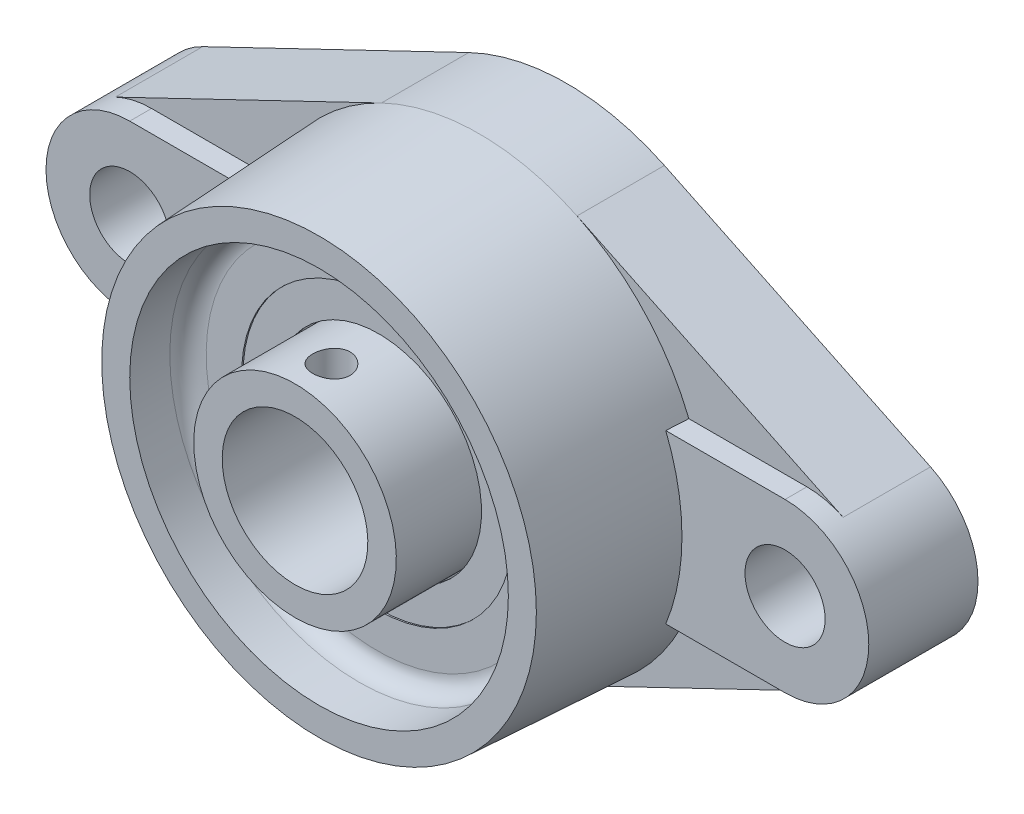
from build123d import *

# Parameters (mm, degrees)
SKETCH_2_R               = 5.5
EXTRUDE_671_DEPTH        = 12
SKETCH_3_R               = 5.5
EXTRUDE_1_DEPTH          = 15
SKETCH_4_R               = 31
EXTRUDE_2_DEPTH          = 22
EXTRUDE_2_TAPER          = 3
CUT_EXTRUDE_2_DEPTH      = 3
PATTERN_CIRCULAR_1_COUNT = 2
SKETCH_11_W              = 31
SKETCH_11_H              = 3.915
SKETCH_12_W              = 0.2
SKETCH_12_H              = 4.725
SKETCH_13_W              = 2.567
SKETCH_13_H              = 15.915


with BuildPart() as part:
    # 草图2 → Extrude 671 (new body)
    with BuildSketch(Plane.XY):
        with BuildLine():
            Line((-49.983333333, 10.364187807), (-13.433333333, 27.938245391))
            ThreePointArc((-13.433333333, 27.938245391), (0, 31), (13.433333333, 27.938245391))
            Line((13.433333333, 27.938245391), (49.983333333, 10.364187807))
            ThreePointArc((49.983333333, 10.364187807), (56.5, 0), (49.983333333, -10.364187807))
            Line((49.983333333, -10.364187807), (13.433333333, -27.938245391))
            ThreePointArc((13.433333333, -27.938245391), (0, -31), (-13.433333333, -27.938245391))
            Line((-13.433333333, -27.938245391), (-49.983333333, -10.364187807))
            ThreePointArc((-49.983333333, -10.364187807), (-56.5, 0), (-49.983333333, 10.364187807))
        make_face()
        with Locations((-45, 0)):
            Circle(SKETCH_2_R, mode=Mode.SUBTRACT)
        with Locations(Location((45, 0, 0), (0, 0, 180))):
            Circle(SKETCH_2_R, mode=Mode.SUBTRACT)
    extrude(amount=EXTRUDE_671_DEPTH)

    # 草图3 → 凸台-拉伸1 (add)
    with BuildSketch(Plane.XY):
        with BuildLine():
            Line((-45, 11.5), (45, 11.5))
            ThreePointArc((45, 11.5), (56.5, 0), (45, -11.5))
            Line((45, -11.5), (-45, -11.5))
            ThreePointArc((-45, -11.5), (-56.5, 0), (-45, 11.5))
        make_face()
        with Locations(Location((45, 0, 0), (0, 0, 180))):
            Circle(SKETCH_3_R, mode=Mode.SUBTRACT)
        with Locations((-45, 0)):
            Circle(SKETCH_3_R, mode=Mode.SUBTRACT)
    extrude(amount=EXTRUDE_1_DEPTH)

    # 草图4 → 凸台-拉伸2 (add)
    with BuildSketch(Plane.XY.offset(12)):
        Circle(SKETCH_4_R)
    extrude(amount=EXTRUDE_2_DEPTH, taper=EXTRUDE_2_TAPER)

    # 草图5 → 切除-拉伸2 (cut)
    with BuildSketch(Plane(origin=(0, 0, 0), x_dir=(-1, 0, 0), z_dir=(0, 0, -1))):
        with BuildLine():
            Line((-34.96012629, 11.740142073), (-11.149666667, 23.188743675))
            ThreePointArc((-11.149666667, 23.188743675), (0, 25.73), (11.149666667, 23.188743675))
            Line((11.149666667, 23.188743675), (34.96012629, 11.740142073))
            ThreePointArc((34.96012629, 11.740142073), (36.584583298, 9.705433588), (36.006307058, 7.166832443))
            ThreePointArc((36.006307058, 7.166832443), (33.5, 0), (36.006307058, -7.166832443))
            ThreePointArc((36.006307058, -7.166832443), (36.584583298, -9.705433588), (34.96012629, -11.740142073))
            Line((34.96012629, -11.740142073), (11.149666667, -23.188743675))
            ThreePointArc((11.149666667, -23.188743675), (0, -25.73), (-11.149666667, -23.188743675))
            Line((-11.149666667, -23.188743675), (-34.96012629, -11.740142073))
            ThreePointArc((-34.96012629, -11.740142073), (-36.584583298, -9.705433588), (-36.006307058, -7.166832443))
            ThreePointArc((-36.006307058, -7.166832443), (-33.5, 0), (-36.006307058, 7.166832443))
            ThreePointArc((-36.006307058, 7.166832443), (-36.584583298, 9.705433588), (-34.96012629, 11.740142073))
        make_face()
    extrude(amount=-CUT_EXTRUDE_2_DEPTH, mode=Mode.SUBTRACT)

    # 草图6 → 切除-旋转1 (revolve, cut)
    with BuildSketch(Plane(origin=(0, 0, 0), x_dir=(0, 0, -1), z_dir=(1, 0, 0))):
        with BuildLine():
            Line((-36, 26), (-28.5, 26))
            ThreePointArc((-28.5, 26), (-26.732233047, 25.267766953), (-26, 23.5))
            Line((-26, 23.5), (-26, 22.433234274))
            ThreePointArc((-26, 22.433234274), (-24.841010415, 22.762526163), (-23.666666667, 23.031982594))
            Line((-23.666666667, 23.031982594), (-23.666666667, 25.267766953))
            Line((-23.666666667, 25.267766953), (-21.333333333, 25.267766953))
            Line((-21.333333333, 25.267766953), (-21.333333333, 23.383873836))
            ThreePointArc((-21.333333333, 23.383873836), (-16.618745428, 23.379042467), (-12, 22.433234274))
            Line((-12, 22.433234274), (-12, 23.5))
            ThreePointArc((-12, 23.5), (-11.267766953, 25.267766953), (-9.5, 26))
            Line((-9.5, 26), (2, 26))
            Line((2, 26), (2, 0))
            Line((2, 0), (-36, 0))
            Line((-36, 0), (-36, 26))
        make_face()
    revolve(axis=Axis((0, 0, 0), (0, 0, 1)), mode=Mode.SUBTRACT)

    # 草图7 → 凸台-旋转1 (revolve)
    with BuildSketch(Plane.XY.offset(18.5)):
        with BuildLine():
            Line((-21.679433892, -21.679433892), (-18.850924901, -24.507942884))
            Line((-18.850924901, -24.507942884), (-19.156642158, -24.813660141))
            ThreePointArc((-19.156642158, -24.813660141), (-19.904442449, -25.676726722), (-20.521738978, -26.637473407))
            ThreePointArc((-20.521738978, -26.637473407), (-22.766611284, -28.272961601), (-25.455384104, -27.576704447))
            Line((-25.455384104, -27.576704447), (-26.0493538, -26.982734751))
            ThreePointArc((-26.0493538, -26.982734751), (-26.516044275, -27.176044275), (-26.982734751, -26.982734751))
            Line((-26.982734751, -26.982734751), (-21.679433892, -21.679433892))
        make_face()
    revolve(axis=Axis((-26.982734751, -26.982734751, 18.5), (0.7071067811865517, 0.7071067811865434, 0)))

    # 草图8 → 凸台-旋转2 (revolve)
    with BuildSketch(Plane(origin=(0, 0, 0), x_dir=(0, 0, -1), z_dir=(1, 0, 0)), mode=Mode.PRIVATE) as revolve_2_sk:
        with BuildLine():
            Line((-26, 22.433234274), (-26, 18.64))
            Line((-26, 18.64), (-12, 18.64))
            Line((-12, 18.64), (-12, 22.433234274))
            ThreePointArc((-12, 22.433234274), (-19, 23.5), (-26, 22.433234274))
        make_face()
    revolve(revolve_2_sk.sketch.rotate(Axis((0, 0, 19), (0, 0, -1)), 180), axis=Axis((0, 0, 19), (0, 0, -1)))

    # 草图9 → 凸台-旋转3 (revolve)
    with BuildSketch(Plane(origin=(0, 0, 0), x_dir=(0, 0, -1), z_dir=(1, 0, 0))):
        with BuildLine():
            Line((-19, 20.5975), (-19, 12.9025))
            ThreePointArc((-19, 12.9025), (-15.1525, 16.75), (-19, 20.5975))
        make_face()
    revolve_3 = revolve(axis=Axis((0, 0, 19), (0, 1, 0)))

    # 阵列(圆周)1: 凸台-旋转3 ×2 about axis
    pattern_circular_1_axis = Axis((0, 0, 0), (0, 0, 1))
    for i in range(1, PATTERN_CIRCULAR_1_COUNT):
        add(revolve_3.rotate(pattern_circular_1_axis, i * 360 / PATTERN_CIRCULAR_1_COUNT))

    # 草图11 → 凸台-旋转4 (revolve)
    with BuildSketch(Plane(origin=(0, 0, 0), x_dir=(0, 0, -1), z_dir=(1, 0, 0)), mode=Mode.PRIVATE) as revolve_4_sk:
        with Locations((-21.8, 11.9575)):
            Rectangle(SKETCH_11_W, SKETCH_11_H)
    revolve(revolve_4_sk.sketch.rotate(Axis((0, 0, 19), (0, 0, -1)), 180), axis=Axis((0, 0, 19), (0, 0, -1)))

    # 草图12 → 凸台-旋转5 (revolve)
    with BuildSketch(Plane(origin=(0, 0, 0), x_dir=(0, 0, -1), z_dir=(1, 0, 0)), mode=Mode.PRIVATE) as revolve_5_sk:
        with Locations((-25.7, 16.4775)):
            Rectangle(SKETCH_12_W, SKETCH_12_H)
        with Locations((-12.3, 16.4775)):
            Rectangle(SKETCH_12_W, SKETCH_12_H)
    revolve(revolve_5_sk.sketch.rotate(Axis((0, 0, 0), (0, 0, 1)), 180), axis=Axis((0, 0, 0), (0, 0, 1)))

    # 草图13 → 切除-旋转2 (revolve, cut)
    with BuildSketch(Plane(origin=(0, 0, 0), x_dir=(0, 0, -1), z_dir=(1, 0, 0)), mode=Mode.PRIVATE) as cut_revolve_2_sk:
        with Locations((-31.0165, 7.9575)):
            Rectangle(SKETCH_13_W, SKETCH_13_H)
    revolve(cut_revolve_2_sk.sketch.rotate(Axis((0, 15.915, 32.3), (0, -1, 0)), 180), axis=Axis((0, 15.915, 32.3), (0, -1, 0)), mode=Mode.SUBTRACT)


solid = part.part
